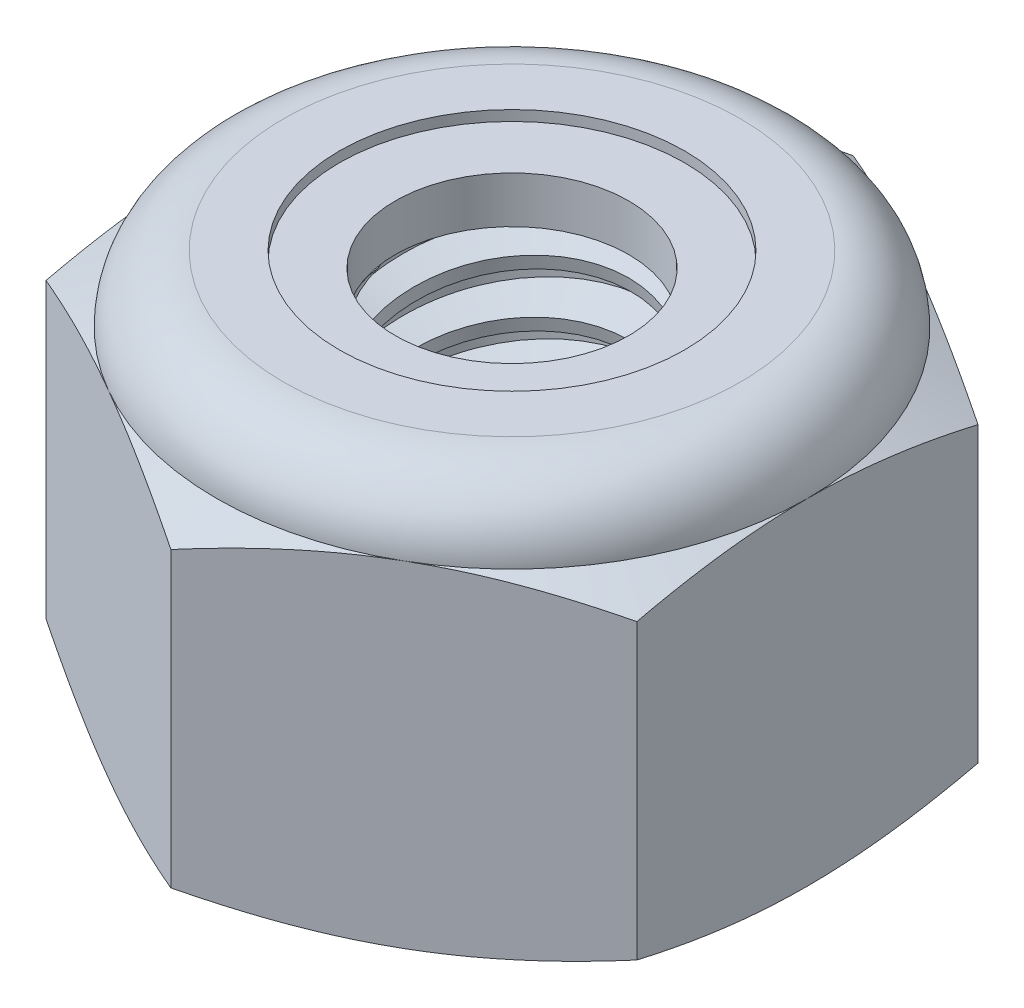
from build123d import *

# Parameters (mm, degrees)
EXTRUDE1_DEPTH      = 5.953125
SKETCH2_W           = 2.0828
SKETCH2_H           = 5.953125
LPATTERN1_COUNT     = 8
LPATTERN1_PITCH     = 0.79375
LPATTERN1_COL_COUNT = 2
LPATTERN1_COL_PITCH = 0.79375


with BuildPart() as part:
    # Sketch1 → Extrude1 (new body)
    with BuildSketch(Plane(origin=(0, 0, 0), x_dir=(1, 0, 0), z_dir=(0, 1, 0))):
        Polygon((0, 5.040989538), (-4.365625, 2.520494769), (-4.365625, -2.520494769), (0, -5.040989538), (4.365625, -2.520494769), (4.365625, 2.520494769), align=None)
    extrude(amount=EXTRUDE1_DEPTH)

    # Sketch4 → Cut-Revolve2 (revolve, cut)
    with BuildSketch(Plane(origin=(0, 0, 0), x_dir=(0, 0, -1), z_dir=(1, 0, 0)), mode=Mode.PRIVATE) as cut_revolve2_sk:
        Polygon((0, 5.953125), (2.0828, 5.953125), (1.725765218, 5.786636947), (1.725765218, 0.166488053), (2.0828, 0), (0, 0), align=None)
    revolve(cut_revolve2_sk.sketch.rotate(Axis((0, 5.953125, 0), (0, 1, 0)), 54.618153421), axis=Axis((0, 5.953125, 0), (0, 1, 0)), mode=Mode.SUBTRACT)


with BuildPart() as body_2:
    # Sketch2 → Revolve1 (revolve)
    with BuildSketch(Plane(origin=(0, 0, 0), x_dir=(0, 0, -1), z_dir=(1, 0, 0))):
        with Locations((1.0414, 2.9765625)):
            Rectangle(SKETCH2_W, SKETCH2_H)
    revolve(axis=Axis((0, -2.0828, 0), (0, 1, 0)))

    # Sketch3 → Cut-Revolve1 (revolve, cut)
    with BuildSketch(Plane(origin=(0, 0, 0), x_dir=(0, 0, -1), z_dir=(1, 0, 0)), mode=Mode.PRIVATE) as cut_revolve1_sk:
        Polygon((2.101371857, 5.855659896), (2.231374854, 5.173404168), (1.762908932, 5.33664843), (1.725765218, 5.531578638), align=None)
    cut_revolve1 = revolve(cut_revolve1_sk.sketch.rotate(Axis((0, 5.953125, 0.162231854), (0, -0.9823254572523515, -0.1871809179215616)), 180), axis=Axis((0, 5.953125, 0.162231854), (0, -0.9823254572523515, -0.1871809179215616)), mode=Mode.SUBTRACT)

    # LPattern1: Cut-Revolve1 ×8
    with Locations(*[(0, -i * LPATTERN1_PITCH, 0) for i in range(1, LPATTERN1_COUNT)]):
        add(cut_revolve1, mode=Mode.SUBTRACT)

    # LPattern1 col: Cut-Revolve1 ×2
    with Locations(*[(0, i * LPATTERN1_COL_PITCH, 0) for i in range(1, LPATTERN1_COL_COUNT)]):
        add(cut_revolve1, mode=Mode.SUBTRACT)


with BuildPart() as part_1:
    add(part.part)

    # Combine1: cut body 2
    add(body_2.part, mode=Mode.SUBTRACT)

    # Sketch5 → Cut-Revolve3 (revolve, cut)
    with BuildSketch(Plane(origin=(0, 0, 0), x_dir=(0, 0, -1), z_dir=(1, 0, 0)), mode=Mode.PRIVATE) as cut_revolve3_sk:
        with BuildLine():
            Line((0, 0), (4.365625, 0))
            Line((4.365625, 0), (5.040989538, 0.314927656))
            Line((5.040989538, 0.314927656), (5.040989538, 4.646009844))
            Line((5.040989538, 4.646009844), (4.365625, 4.9609375))
            ThreePointArc((4.365625, 4.9609375), (4.075020009, 5.662520009), (3.3734375, 5.953125))
            Line((3.3734375, 5.953125), (3.3734375, 7.223125))
            Line((3.3734375, 7.223125), (6.310989538, 7.223125))
            Line((6.310989538, 7.223125), (6.310989538, -1.27))
            Line((6.310989538, -1.27), (0, -1.27))
            Line((0, -1.27), (0, 0))
        make_face()
    revolve(cut_revolve3_sk.sketch.rotate(Axis((0, 0, 0), (0, 1, 0)), 54.618153421), axis=Axis((0, 0, 0), (0, 1, 0)), mode=Mode.SUBTRACT)

    # Sketch6 → Cut-Revolve4 (revolve, cut)
    with BuildSketch(Plane(origin=(0, 0, 0), x_dir=(0, 0, -1), z_dir=(1, 0, 0)), mode=Mode.PRIVATE) as cut_revolve4_sk:
        with BuildLine():
            Line((0, 4.9609375), (4.213225, 4.9609375))
            ThreePointArc((4.213225, 4.9609375), (3.967256936, 5.554756936), (3.3734375, 5.800725))
            Line((3.3734375, 5.800725), (2.549601359, 5.800725))
            Line((2.549601359, 5.800725), (2.549601359, 7.223125))
            Line((2.549601359, 7.223125), (0, 7.223125))
            Line((0, 7.223125), (0, 4.9609375))
        make_face()
    revolve(cut_revolve4_sk.sketch.rotate(Axis((0, 7.223125, 0), (0, 1, 0)), 54.618153421), axis=Axis((0, 7.223125, 0), (0, 1, 0)), mode=Mode.SUBTRACT)


with BuildPart() as body_2_2:
    # Sketch7 → Revolve2 (revolve)
    with BuildSketch(Plane(origin=(0, 0, 0), x_dir=(0, 0, -1), z_dir=(1, 0, 0))):
        with BuildLine():
            Line((1.725765218, 5.0371375), (4.133213408, 5.0371375))
            ThreePointArc((4.133213408, 5.0371375), (3.885726726, 5.527175629), (3.3734375, 5.724525))
            Line((3.3734375, 5.724525), (1.725765218, 5.724525))
            Line((1.725765218, 5.724525), (1.725765218, 5.0371375))
        make_face()
    revolve(axis=Axis((0, 5.0371375, 0), (0, 1, 0)))


solid = Compound([part_1.part, body_2_2.part])
